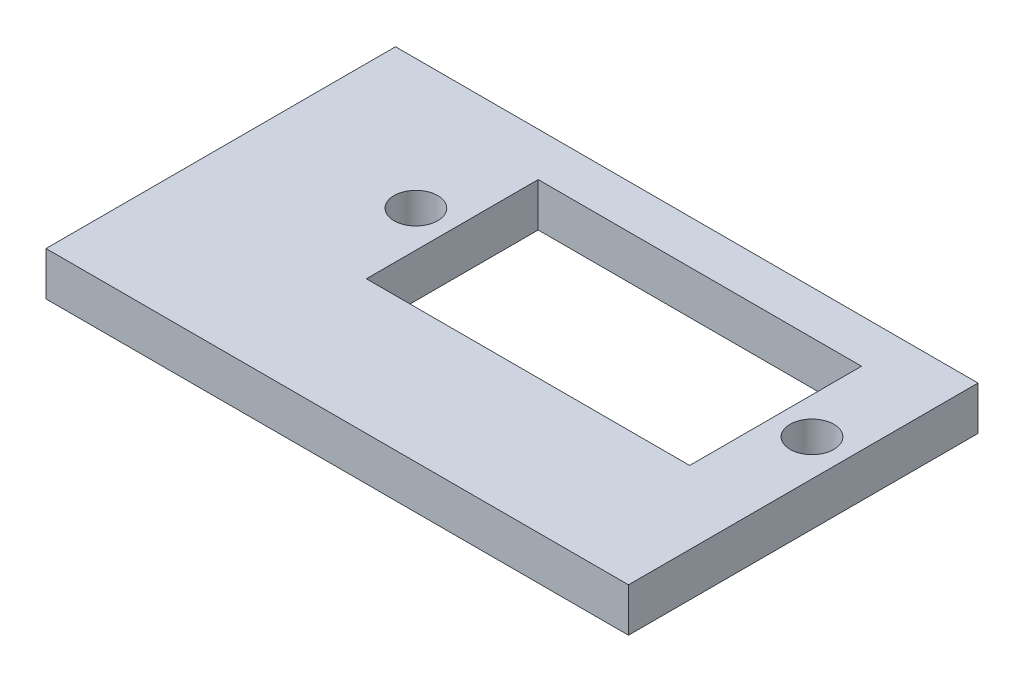
from build123d import *

# Parameters (mm, degrees)
SKETCH1_W           = 40
SKETCH1_H           = 21
BOSS_EXTRUDE1_DEPTH = 3
SKETCH2_W           = 40
SKETCH2_H           = 3
BOSS_EXTRUDE2_DEPTH = 3
SKETCH3_W           = 22.2
SKETCH3_H           = 11.8
CUT_EXTRUDE1_DEPTH  = 10
SKETCH4_R           = 1.5
CUT_EXTRUDE2_DEPTH  = 10


with BuildPart() as part:
    # Sketch1 → Boss-Extrude1 (new body)
    with BuildSketch(Plane(origin=(0, 0, 0), x_dir=(1, 0, 0), z_dir=(0, 1, 0))):
        with Locations((20, 10.5)):
            Rectangle(SKETCH1_W, SKETCH1_H)
    extrude(amount=BOSS_EXTRUDE1_DEPTH)

    # Sketch2 → Boss-Extrude2 (add)
    with BuildSketch(Plane(origin=(0, 0, -21), x_dir=(-1, 0, 0), z_dir=(0, 0, -1))):
        with Locations((-20, 1.5)):
            Rectangle(SKETCH2_W, SKETCH2_H)
    extrude(amount=BOSS_EXTRUDE2_DEPTH)

    # Sketch3 → Cut-Extrude1 (cut)
    with BuildSketch(Plane(origin=(0, 3, 0), x_dir=(1, 0, 0), z_dir=(0, 1, 0))):
        with Locations((23.9, 15.1)):
            Rectangle(SKETCH3_W, SKETCH3_H)
    extrude(amount=-CUT_EXTRUDE1_DEPTH, mode=Mode.SUBTRACT)

    # Sketch4 → Cut-Extrude2 (cut)
    with BuildSketch(Plane(origin=(0, 3, 0), x_dir=(1, 0, 0), z_dir=(0, 1, 0))):
        with Locations(Location((10.3, 15.1, 0), (0, 0, 270))):
            Circle(SKETCH4_R)
        with Locations(Location((37.5, 15.1, 0), (0, 0, 270))):
            Circle(SKETCH4_R)
    extrude(amount=-CUT_EXTRUDE2_DEPTH, mode=Mode.SUBTRACT)


solid = part.part
